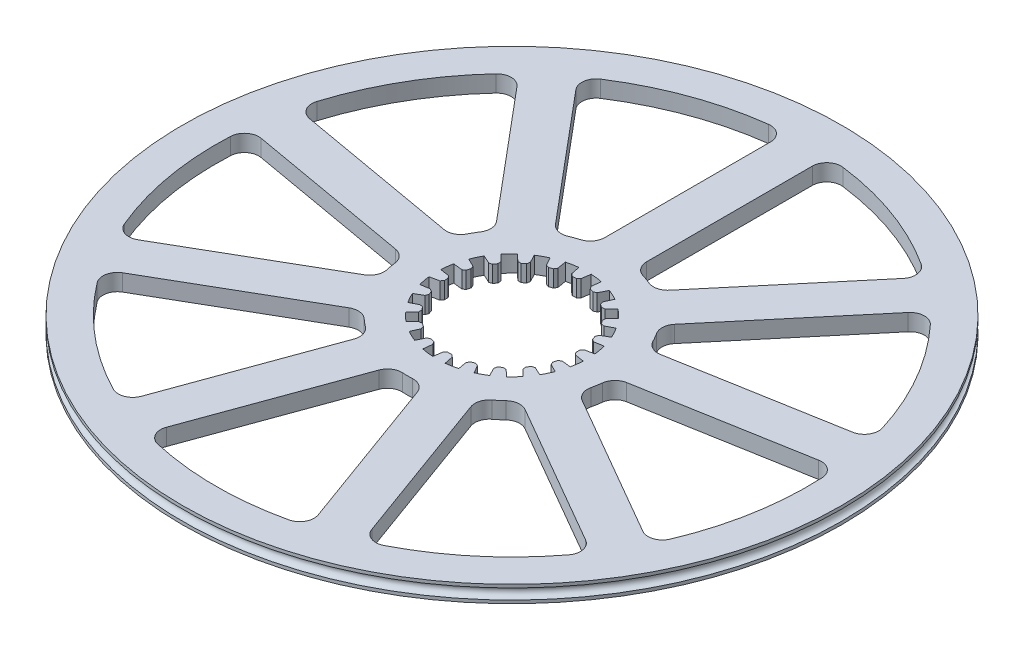
from build123d import *

# Parameters (mm, degrees)
SKETCH1_R           = 2000.25
BOSS_EXTRUDE1_DEPTH = 101.6
SKETCH2_R           = 457.2
CUT_EXTRUDE1_DEPTH  = 2831.60465007
CUT_EXTRUDE2_DEPTH  = 2831.60465007
SKETCH4_R           = 31.75
BOSS_EXTRUDE2_DEPTH = 101.6


with BuildPart() as part:
    # Sketch1 → Boss-Extrude1 (new body)
    with BuildSketch(Plane(origin=(0, 0, 0), x_dir=(1, 0, 0), z_dir=(0, 1, 0))):
        with Locations(Location((0, 0, 0), (0, 0, 270))):
            Circle(SKETCH1_R)
    extrude(amount=BOSS_EXTRUDE1_DEPTH)

    # Sketch2 → Cut-Extrude1 (cut, through all)
    with BuildSketch(Plane(origin=(0, 101.6, 0), x_dir=(1, 0, 0), z_dir=(0, 1, 0))):
        with Locations(Location((0, 0, 0), (0, 0, 270))):
            Circle(SKETCH2_R)
    extrude(amount=-CUT_EXTRUDE1_DEPTH, mode=Mode.SUBTRACT)

    # Sketch3 → Cut-Extrude2 (cut, through all)
    with BuildSketch(Plane(origin=(0, 101.6, 0), x_dir=(1, 0, 0), z_dir=(0, 1, 0))):
        with BuildLine():
            Line((-127, 1695.904510607), (-127, 690.012425086))
            ThreePointArc((-127, 690.012425086), (-144.059856059, 638.065293113), (-188.596164325, 606.346837051))
            ThreePointArc((-188.596164325, 606.346837051), (-217.182791012, 596.704814199), (-245.279190355, 585.715902788))
            ThreePointArc((-245.279190355, 585.715902788), (-299.784212374, 581.386262664), (-346.243793099, 610.21421035))
            Line((-346.243793099, 610.21421035), (-992.818762354, 1380.772252841))
            ThreePointArc((-992.818762354, 1380.772252841), (-1012.331180181, 1450.204456643), (-973.146490328, 1510.752994656))
            ThreePointArc((-973.146490328, 1510.752994656), (-614.627298563, 1688.674624183), (-225.619845005, 1782.830442874))
            ThreePointArc((-225.619845005, 1782.830442874), (-156.682781069, 1761.635004918), (-127, 1695.904510607))
        make_face()
        with BuildLine():
            Line((127, 690.012425086), (127, 1695.904510607))
            ThreePointArc((127, 1695.904510607), (156.682781069, 1761.635004918), (225.619845005, 1782.830442874))
            ThreePointArc((225.619845005, 1782.830442874), (614.627298563, 1688.674624183), (973.146490328, 1510.752994656))
            ThreePointArc((973.146490328, 1510.752994656), (1012.331180181, 1450.204456643), (992.818762354, 1380.772252841))
            Line((992.818762354, 1380.772252841), (346.243793099, 610.21421035))
            ThreePointArc((346.243793099, 610.21421035), (299.784212374, 581.386262664), (245.279190355, 585.715902788))
            ThreePointArc((245.279190355, 585.715902788), (217.182791012, 596.704814199), (188.596164325, 606.346837051))
            ThreePointArc((188.596164325, 606.346837051), (144.059856059, 638.065293113), (127, 690.012425086))
        make_face()
        with BuildLine():
            Line((540.819081651, 446.94615749), (1187.394050906, 1217.504199981))
            ThreePointArc((1187.394050906, 1217.504199981), (1252.383127721, 1248.776955999), (1318.816147375, 1220.701712919))
            ThreePointArc((1318.816147375, 1220.701712919), (1556.290951871, 898.525), (1716.566767518, 531.777430088))
            ThreePointArc((1716.566767518, 531.777430088), (1707.664131416, 460.207125878), (1648.086591851, 419.561312397))
            Line((1648.086591851, 419.561312397), (657.476267336, 244.889984816))
            ThreePointArc((657.476267336, 244.889984816), (603.355916106, 252.670138526), (564.385685893, 291.021988103))
            ThreePointArc((564.385685893, 291.021988103), (549.926131403, 317.5), (534.225277704, 343.261347464))
            ThreePointArc((534.225277704, 343.261347464), (520.496716795, 396.186481609), (540.819081651, 446.94615749))
        make_face()
        with BuildLine():
            Line((701.582904463, -5.251184449), (1692.193228978, 169.420143132))
            ThreePointArc((1692.193228978, 169.420143132), (1762.079490225, 151.602290758), (1794.92371738, 87.3930849))
            ThreePointArc((1794.92371738, 87.3930849), (1769.748772551, -312.054457676), (1656.786376672, -696.022704065))
            ThreePointArc((1656.786376672, -696.022704065), (1603.962056989, -745.126233718), (1532.196388578, -737.967029023))
            Line((1532.196388578, -737.967029023), (661.068289051, -235.020986262))
            ThreePointArc((661.068289051, -235.020986262), (624.610681139, -194.273151544), (619.409846553, -139.844349164))
            ThreePointArc((619.409846553, -139.844349164), (625.352923163, -110.266592819), (629.884446392, -80.439941527))
            ThreePointArc((629.884446392, -80.439941527), (653.387379066, -31.072387763), (701.582904463, -5.251184449))
        make_face()
        with BuildLine():
            Line((534.068289051, -454.991438824), (1405.196388578, -957.937481584))
            ThreePointArc((1405.196388578, -957.937481584), (1447.27927592, -1016.5087712), (1431.166531667, -1086.807738809))
            ThreePointArc((1431.166531667, -1086.807738809), (1155.121473987, -1376.620166507), (821.777227051, -1598.146079556))
            ThreePointArc((821.777227051, -1598.146079556), (749.748310044, -1601.806747402), (699.374466624, -1550.192395973))
            Line((699.374466624, -1550.192395973), (355.339111364, -604.963025901))
            ThreePointArc((355.339111364, -604.963025901), (353.603166692, -550.313874902), (384.605256038, -505.275961261))
            ThreePointArc((384.605256038, -505.275961261), (408.170132151, -486.438221381), (430.813682228, -466.502487887))
            ThreePointArc((430.813682228, -466.502487887), (480.55082508, -443.792141569), (534.068289051, -454.991438824))
        make_face()
        with BuildLine():
            Line((116.657185685, -691.836142306), (460.692540945, -1637.065512377))
            ThreePointArc((460.692540945, -1637.065512377), (455.281003695, -1708.984081877), (397.750620143, -1752.479143007))
            ThreePointArc((397.750620143, -1752.479143007), (0, -1797.05), (-397.750620143, -1752.479143007))
            ThreePointArc((-397.750620143, -1752.479143007), (-455.281003695, -1708.984081877), (-460.692540945, -1637.065512377))
            Line((-460.692540945, -1637.065512377), (-116.657185685, -691.836142306))
            ThreePointArc((-116.657185685, -691.836142306), (-82.859199312, -648.856620135), (-30.160408189, -634.283335567))
            ThreePointArc((-30.160408189, -634.283335567), (0, -635), (30.160408189, -634.283335567))
            ThreePointArc((30.160408189, -634.283335567), (82.859199312, -648.856620135), (116.657185685, -691.836142306))
        make_face()
        with BuildLine():
            Line((-355.339111364, -604.963025901), (-699.374466624, -1550.192395973))
            ThreePointArc((-699.374466624, -1550.192395973), (-749.748310044, -1601.806747402), (-821.777227051, -1598.146079556))
            ThreePointArc((-821.777227051, -1598.146079556), (-1155.121473987, -1376.620166507), (-1431.166531667, -1086.807738809))
            ThreePointArc((-1431.166531667, -1086.807738809), (-1447.27927592, -1016.5087712), (-1405.196388578, -957.937481584))
            Line((-1405.196388578, -957.937481584), (-534.068289051, -454.991438824))
            ThreePointArc((-534.068289051, -454.991438824), (-480.55082508, -443.792141569), (-430.813682228, -466.502487887))
            ThreePointArc((-430.813682228, -466.502487887), (-408.170132151, -486.438221381), (-384.605256038, -505.275961261))
            ThreePointArc((-384.605256038, -505.275961261), (-353.603166692, -550.313874902), (-355.339111364, -604.963025901))
        make_face()
        with BuildLine():
            Line((-661.068289051, -235.020986262), (-1532.196388578, -737.967029023))
            ThreePointArc((-1532.196388578, -737.967029023), (-1603.962056989, -745.126233718), (-1656.786376672, -696.022704065))
            ThreePointArc((-1656.786376672, -696.022704065), (-1769.748772551, -312.054457676), (-1794.92371738, 87.3930849))
            ThreePointArc((-1794.92371738, 87.3930849), (-1762.079490225, 151.602290758), (-1692.193228978, 169.420143132))
            Line((-1692.193228978, 169.420143132), (-701.582904463, -5.251184449))
            ThreePointArc((-701.582904463, -5.251184449), (-653.387379066, -31.072387763), (-629.884446392, -80.439941527))
            ThreePointArc((-629.884446392, -80.439941527), (-625.352923163, -110.266592819), (-619.409846553, -139.844349164))
            ThreePointArc((-619.409846553, -139.844349164), (-624.610681139, -194.273151544), (-661.068289051, -235.020986262))
        make_face()
        with BuildLine():
            Line((-657.476267336, 244.889984816), (-1648.086591851, 419.561312397))
            ThreePointArc((-1648.086591851, 419.561312397), (-1707.664131416, 460.207125878), (-1716.566767518, 531.777430088))
            ThreePointArc((-1716.566767518, 531.777430088), (-1556.290951871, 898.525), (-1318.816147375, 1220.701712919))
            ThreePointArc((-1318.816147375, 1220.701712919), (-1252.383127721, 1248.776955999), (-1187.394050906, 1217.504199981))
            Line((-1187.394050906, 1217.504199981), (-540.819081651, 446.94615749))
            ThreePointArc((-540.819081651, 446.94615749), (-520.496716795, 396.186481609), (-534.225277704, 343.261347464))
            ThreePointArc((-534.225277704, 343.261347464), (-549.926131403, 317.5), (-564.385685893, 291.021988103))
            ThreePointArc((-564.385685893, 291.021988103), (-603.355916106, 252.670138526), (-657.476267336, 244.889984816))
        make_face()
    extrude(amount=-CUT_EXTRUDE2_DEPTH, mode=Mode.SUBTRACT)

    # Cut-Sweep1: sweep along a path in Sketch6
    with BuildLine(Plane(origin=(0, 50.8, 0), x_dir=(1, 0, 0), z_dir=(0, 1, 0))) as cut_sweep1_path:
        CenterArc((0, 0), 1714.5, 0, 360)
    # Sketch4 → Cut-Sweep1 (sweep, cut)
    with BuildSketch(Plane.XY):
        with Locations((2000.25, 50.8)):
            Circle(SKETCH4_R)
    sweep(path=cut_sweep1_path.line, mode=Mode.SUBTRACT)

    # Sketch7 → Boss-Extrude2 (add)
    with BuildSketch(Plane(origin=(0, 101.6, 0), x_dir=(1, 0, 0), z_dir=(0, 1, 0))):
        with BuildLine():
            Line((-48.84009099, 454.583859714), (-37.7960553, 400.470903463))
            Line((-37.7960553, 400.470903463), (-22.560994802, 388.367665848))
            Line((-22.560994802, 388.367665848), (1.726419435, 389.018588037))
            Line((1.726419435, 389.018588037), (16.291322167, 401.920488578))
            Line((16.291322167, 401.920488578), (24.421044378, 456.547316925))
            ThreePointArc((24.421044378, 456.547316925), (-12.248928541, 457.035888908), (-48.84009099, 454.583859714))
        make_face()
        with BuildLine():
            Line((94.024451228, 447.427360106), (87.806130239, 392.550085733))
            Line((87.806130239, 392.550085733), (98.555427692, 376.331330127))
            Line((98.555427692, 376.331330127), (121.855277285, 369.445170168))
            Line((121.855277285, 369.445170168), (139.694229464, 377.214804284))
            Line((139.694229464, 377.214804284), (164.306673057, 426.655783025))
            ThreePointArc((164.306673057, 426.655783025), (129.582433405, 438.452087408), (94.024451228, 447.427360106))
        make_face()
        with BuildLine():
            Line((227.685225052, 396.473553081), (204.81323997, 346.203730554))
            Line((204.81323997, 346.203730554), (210.024558248, 327.457061758))
            Line((210.024558248, 327.457061758), (230.056091578, 313.707884967))
            Line((230.056091578, 313.707884967), (249.422892274, 315.584706737))
            Line((249.422892274, 315.584706737), (288.108819785, 355.000208397))
            ThreePointArc((288.108819785, 355.000208397), (258.729363916, 376.949540718), (227.685225052, 396.473553081))
        make_face()
        with BuildLine():
            Line((339.058582672, 306.710152287), (301.771802754, 265.968542086))
            Line((301.771802754, 265.968542086), (300.935021715, 246.529014657))
            Line((300.935021715, 246.529014657), (315.737412733, 227.262686253))
            Line((315.737412733, 227.262686253), (334.736304557, 223.062979286))
            Line((334.736304557, 223.062979286), (383.70886786, 248.59473994))
            ThreePointArc((383.70886786, 248.59473994), (362.550061613, 278.548546621), (339.058582672, 306.710152287))
        make_face()
        with BuildLine():
            Line((417.242523861, 186.923824812), (369.190838917, 159.698499606))
            Line((369.190838917, 159.698499606), (362.387868519, 141.468989933))
            Line((362.387868519, 141.468989933), (370.512156058, 118.571432378))
            Line((370.512156058, 118.571432378), (387.283395105, 108.706293252))
            Line((387.283395105, 108.706293252), (441.748818492, 117.855086275))
            ThreePointArc((441.748818492, 117.855086275), (430.881833244, 152.881280018), (417.242523861, 186.923824812))
        make_face()
        with BuildLine():
            Line((454.583859714, 48.84009099), (400.470903463, 37.7960553))
            Line((400.470903463, 37.7960553), (388.367665848, 22.560994802))
            Line((388.367665848, 22.560994802), (389.018588037, -1.726419435))
            Line((389.018588037, -1.726419435), (401.920488578, -16.291322167))
            Line((401.920488578, -16.291322167), (456.547316925, -24.421044378))
            ThreePointArc((456.547316925, -24.421044378), (457.035888908, 12.248928541), (454.583859714, 48.84009099))
        make_face()
        with BuildLine():
            Line((447.427360106, -94.024451228), (392.550085733, -87.806130239))
            Line((392.550085733, -87.806130239), (376.331330127, -98.555427692))
            Line((376.331330127, -98.555427692), (369.445170168, -121.855277285))
            Line((369.445170168, -121.855277285), (377.214804284, -139.694229464))
            Line((377.214804284, -139.694229464), (426.655783025, -164.306673057))
            ThreePointArc((426.655783025, -164.306673057), (438.452087408, -129.582433405), (447.427360106, -94.024451228))
        make_face()
        with BuildLine():
            Line((396.473553081, -227.685225052), (346.203730554, -204.81323997))
            Line((346.203730554, -204.81323997), (327.457061758, -210.024558248))
            Line((327.457061758, -210.024558248), (313.707884967, -230.056091578))
            Line((313.707884967, -230.056091578), (315.584706737, -249.422892274))
            Line((315.584706737, -249.422892274), (355.000208397, -288.108819785))
            ThreePointArc((355.000208397, -288.108819785), (376.949540718, -258.729363916), (396.473553081, -227.685225052))
        make_face()
        with BuildLine():
            Line((306.710152287, -339.058582672), (265.968542086, -301.771802754))
            Line((265.968542086, -301.771802754), (246.529014657, -300.935021715))
            Line((246.529014657, -300.935021715), (227.262686253, -315.737412733))
            Line((227.262686253, -315.737412733), (223.062979286, -334.736304557))
            Line((223.062979286, -334.736304557), (248.59473994, -383.70886786))
            ThreePointArc((248.59473994, -383.70886786), (278.548546621, -362.550061613), (306.710152287, -339.058582672))
        make_face()
        with BuildLine():
            Line((186.923824812, -417.242523861), (159.698499606, -369.190838917))
            Line((159.698499606, -369.190838917), (141.468989933, -362.387868519))
            Line((141.468989933, -362.387868519), (118.571432378, -370.512156058))
            Line((118.571432378, -370.512156058), (108.706293252, -387.283395105))
            Line((108.706293252, -387.283395105), (117.855086275, -441.748818492))
            ThreePointArc((117.855086275, -441.748818492), (152.881280018, -430.881833244), (186.923824812, -417.242523861))
        make_face()
        with BuildLine():
            Line((48.84009099, -454.583859714), (37.7960553, -400.470903463))
            Line((37.7960553, -400.470903463), (22.560994802, -388.367665848))
            Line((22.560994802, -388.367665848), (-1.726419435, -389.018588037))
            Line((-1.726419435, -389.018588037), (-16.291322167, -401.920488578))
            Line((-16.291322167, -401.920488578), (-24.421044378, -456.547316925))
            ThreePointArc((-24.421044378, -456.547316925), (12.248928541, -457.035888908), (48.84009099, -454.583859714))
        make_face()
        with BuildLine():
            Line((-94.024451228, -447.427360106), (-87.806130239, -392.550085733))
            Line((-87.806130239, -392.550085733), (-98.555427692, -376.331330127))
            Line((-98.555427692, -376.331330127), (-121.855277285, -369.445170168))
            Line((-121.855277285, -369.445170168), (-139.694229464, -377.214804284))
            Line((-139.694229464, -377.214804284), (-164.306673057, -426.655783025))
            ThreePointArc((-164.306673057, -426.655783025), (-129.582433405, -438.452087408), (-94.024451228, -447.427360106))
        make_face()
        with BuildLine():
            Line((-227.685225052, -396.473553081), (-204.81323997, -346.203730554))
            Line((-204.81323997, -346.203730554), (-210.024558248, -327.457061758))
            Line((-210.024558248, -327.457061758), (-230.056091578, -313.707884967))
            Line((-230.056091578, -313.707884967), (-249.422892274, -315.584706737))
            Line((-249.422892274, -315.584706737), (-288.108819785, -355.000208397))
            ThreePointArc((-288.108819785, -355.000208397), (-258.729363916, -376.949540718), (-227.685225052, -396.473553081))
        make_face()
        with BuildLine():
            Line((-339.058582672, -306.710152287), (-301.771802754, -265.968542086))
            Line((-301.771802754, -265.968542086), (-300.935021715, -246.529014657))
            Line((-300.935021715, -246.529014657), (-315.737412733, -227.262686253))
            Line((-315.737412733, -227.262686253), (-334.736304557, -223.062979286))
            Line((-334.736304557, -223.062979286), (-383.70886786, -248.59473994))
            ThreePointArc((-383.70886786, -248.59473994), (-362.550061613, -278.548546621), (-339.058582672, -306.710152287))
        make_face()
        with BuildLine():
            Line((-417.242523861, -186.923824812), (-369.190838917, -159.698499606))
            Line((-369.190838917, -159.698499606), (-362.387868519, -141.468989933))
            Line((-362.387868519, -141.468989933), (-370.512156058, -118.571432378))
            Line((-370.512156058, -118.571432378), (-387.283395105, -108.706293252))
            Line((-387.283395105, -108.706293252), (-441.748818492, -117.855086275))
            ThreePointArc((-441.748818492, -117.855086275), (-430.881833244, -152.881280018), (-417.242523861, -186.923824812))
        make_face()
        with BuildLine():
            Line((-454.583859714, -48.84009099), (-400.470903463, -37.7960553))
            Line((-400.470903463, -37.7960553), (-388.367665848, -22.560994802))
            Line((-388.367665848, -22.560994802), (-389.018588037, 1.726419435))
            Line((-389.018588037, 1.726419435), (-401.920488578, 16.291322167))
            Line((-401.920488578, 16.291322167), (-456.547316925, 24.421044378))
            ThreePointArc((-456.547316925, 24.421044378), (-457.035888908, -12.248928541), (-454.583859714, -48.84009099))
        make_face()
        with BuildLine():
            Line((-447.427360106, 94.024451228), (-392.550085733, 87.806130239))
            Line((-392.550085733, 87.806130239), (-376.331330127, 98.555427692))
            Line((-376.331330127, 98.555427692), (-369.445170168, 121.855277285))
            Line((-369.445170168, 121.855277285), (-377.214804284, 139.694229464))
            Line((-377.214804284, 139.694229464), (-426.655783025, 164.306673057))
            ThreePointArc((-426.655783025, 164.306673057), (-438.452087408, 129.582433405), (-447.427360106, 94.024451228))
        make_face()
        with BuildLine():
            Line((-396.473553081, 227.685225052), (-346.203730554, 204.81323997))
            Line((-346.203730554, 204.81323997), (-327.457061758, 210.024558248))
            Line((-327.457061758, 210.024558248), (-313.707884967, 230.056091578))
            Line((-313.707884967, 230.056091578), (-315.584706737, 249.422892274))
            Line((-315.584706737, 249.422892274), (-355.000208397, 288.108819785))
            ThreePointArc((-355.000208397, 288.108819785), (-376.949540718, 258.729363916), (-396.473553081, 227.685225052))
        make_face()
        with BuildLine():
            Line((-306.710152287, 339.058582672), (-265.968542086, 301.771802754))
            Line((-265.968542086, 301.771802754), (-246.529014657, 300.935021715))
            Line((-246.529014657, 300.935021715), (-227.262686253, 315.737412733))
            Line((-227.262686253, 315.737412733), (-223.062979286, 334.736304557))
            Line((-223.062979286, 334.736304557), (-248.59473994, 383.70886786))
            ThreePointArc((-248.59473994, 383.70886786), (-278.548546621, 362.550061613), (-306.710152287, 339.058582672))
        make_face()
        with BuildLine():
            Line((-186.923824812, 417.242523861), (-159.698499606, 369.190838917))
            Line((-159.698499606, 369.190838917), (-141.468989933, 362.387868519))
            Line((-141.468989933, 362.387868519), (-118.571432378, 370.512156058))
            Line((-118.571432378, 370.512156058), (-108.706293252, 387.283395105))
            Line((-108.706293252, 387.283395105), (-117.855086275, 441.748818492))
            ThreePointArc((-117.855086275, 441.748818492), (-152.881280018, 430.881833244), (-186.923824812, 417.242523861))
        make_face()
    extrude(amount=-BOSS_EXTRUDE2_DEPTH)


solid = part.part
